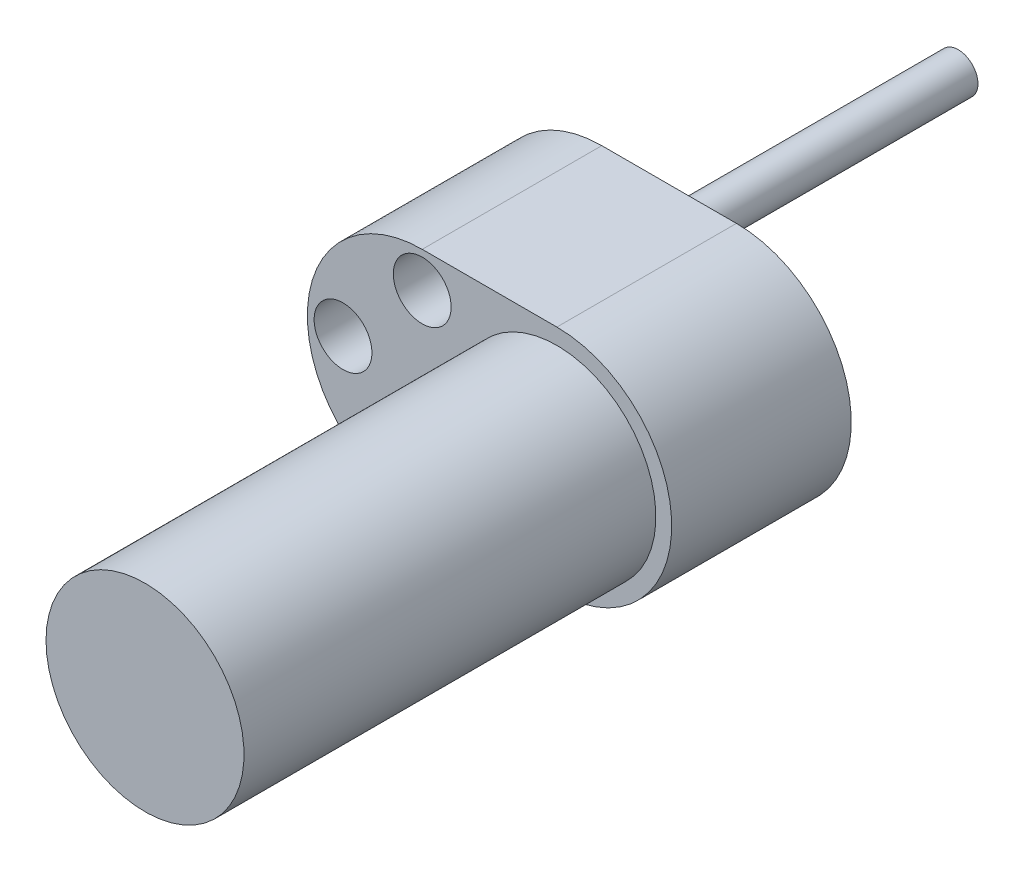
from build123d import *

# Parameters (mm, degrees)
EXTRUDE_1_DEPTH     = 22.67
SKETCH_3_R          = 3.65
CUT_EXTRUDE_1_DEPTH = 22.67
SKETCH_7_R          = 2.5
EXTRUDE_2_DEPTH     = 45
SKETCH_8_R          = 12.5
EXTRUDE_3_DEPTH     = 52


with BuildPart() as part:
    # 草图1 → 凸台-拉伸1 (new body)
    with BuildSketch(Plane.XY):
        with BuildLine():
            Line((-31.5, 35.5), (-14.5, 35.5))
            ThreePointArc((-14.5, 35.5), (0, 21), (-14.5, 6.5))
            Line((-14.5, 6.5), (-31.5, 6.5))
            ThreePointArc((-31.5, 6.5), (-46, 21), (-31.5, 35.5))
        make_face()
    extrude(amount=EXTRUDE_1_DEPTH)

    # 草图3 → 切除-拉伸1 (cut)
    with BuildSketch(Plane(origin=(0, 0, 0), x_dir=(-1, 0, 0), z_dir=(0, 0, -1))):
        with Locations((31.5, 11)):
            Circle(SKETCH_3_R)
        with Locations((31.5, 31)):
            Circle(SKETCH_3_R)
        with Locations((41.5, 21)):
            Circle(SKETCH_3_R)
    extrude(amount=-CUT_EXTRUDE_1_DEPTH, mode=Mode.SUBTRACT)

    # 草图7 → 凸台-拉伸2 (add)
    with BuildSketch(Plane(origin=(0, 0, 0), x_dir=(-1, 0, 0), z_dir=(0, 0, -1))):
        with Locations(Location((31.5, 21, 0), (0, 0, 180))):
            Circle(SKETCH_7_R)
    extrude(amount=EXTRUDE_2_DEPTH)

    # 草图8 → 凸台-拉伸3 (add)
    with BuildSketch(Plane.XY.offset(22.67)):
        with Locations(Location((-14.5, 21, 0), (0, 0, 180))):
            Circle(SKETCH_8_R)
    extrude(amount=EXTRUDE_3_DEPTH)


solid = part.part
